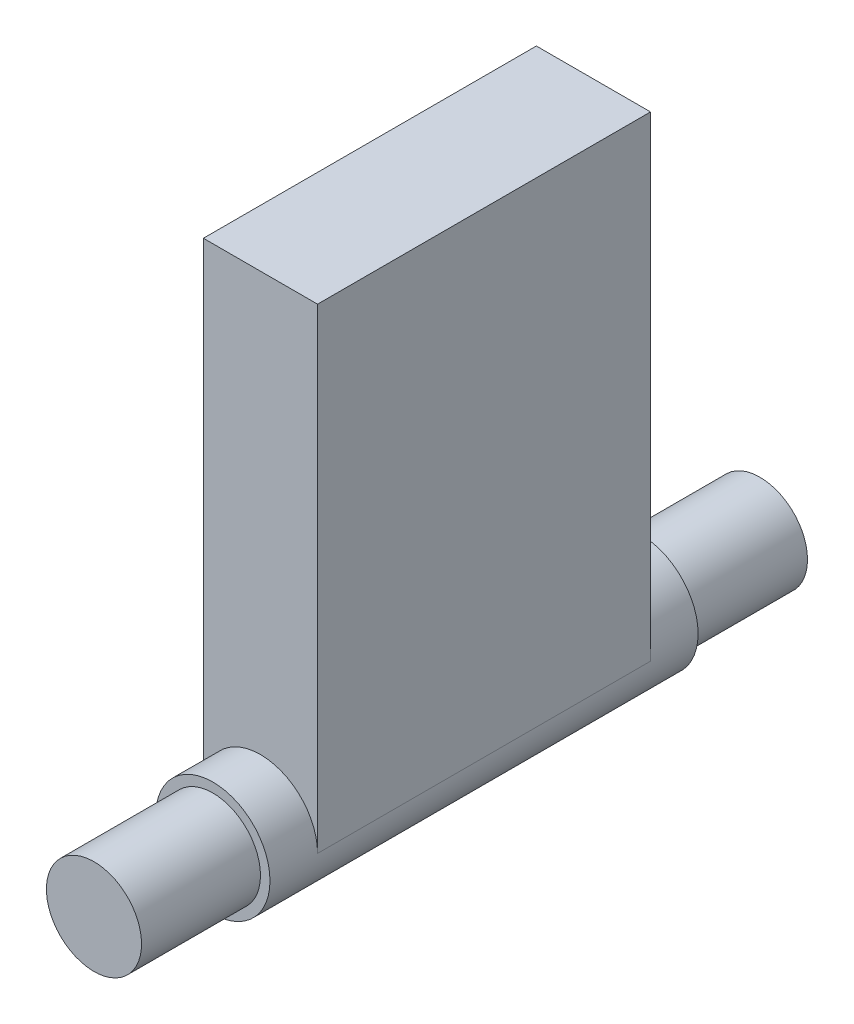
from build123d import *

# Parameters (mm, degrees)
SKETCH_1_R      = 5
EXTRUDE_1_DEPTH = 12.5
SKETCH_2_R      = 6
EXTRUDE_2_DEPTH = 22.5
SKETCH_3_R      = 5
EXTRUDE_3_DEPTH = 12.5
SKETCH_4_W      = 12
SKETCH_4_H      = 35
EXTRUDE_4_DEPTH = 50


with BuildPart() as part:
    # 草图1 → 凸台-拉伸1 (new body)
    with BuildSketch(Plane.XY):
        Circle(SKETCH_1_R)
    extrude(amount=EXTRUDE_1_DEPTH)

    # 草图2 → 凸台-拉伸2 (add)
    with BuildSketch(Plane.XY.offset(12.5)):
        with Locations(Location((0, 0, 0), (0, 0, 180))):
            Circle(SKETCH_2_R)
    extrude_2 = extrude(amount=EXTRUDE_2_DEPTH)

    # 镜向2: 凸台-拉伸2 across plane
    add(extrude_2.mirror(Plane.XY.offset(35)))

    # 草图3 → 凸台-拉伸3 (add)
    with BuildSketch(Plane.XY.offset(57.5)):
        Circle(SKETCH_3_R)
    extrude(amount=EXTRUDE_3_DEPTH)

    # 草图4 → 凸台-拉伸4 (add)
    with BuildSketch(Plane(origin=(0, 0, 0), x_dir=(1, 0, 0), z_dir=(0, 1, 0))):
        with Locations((0, -35)):
            Rectangle(SKETCH_4_W, SKETCH_4_H)
    extrude(amount=EXTRUDE_4_DEPTH)


solid = part.part
